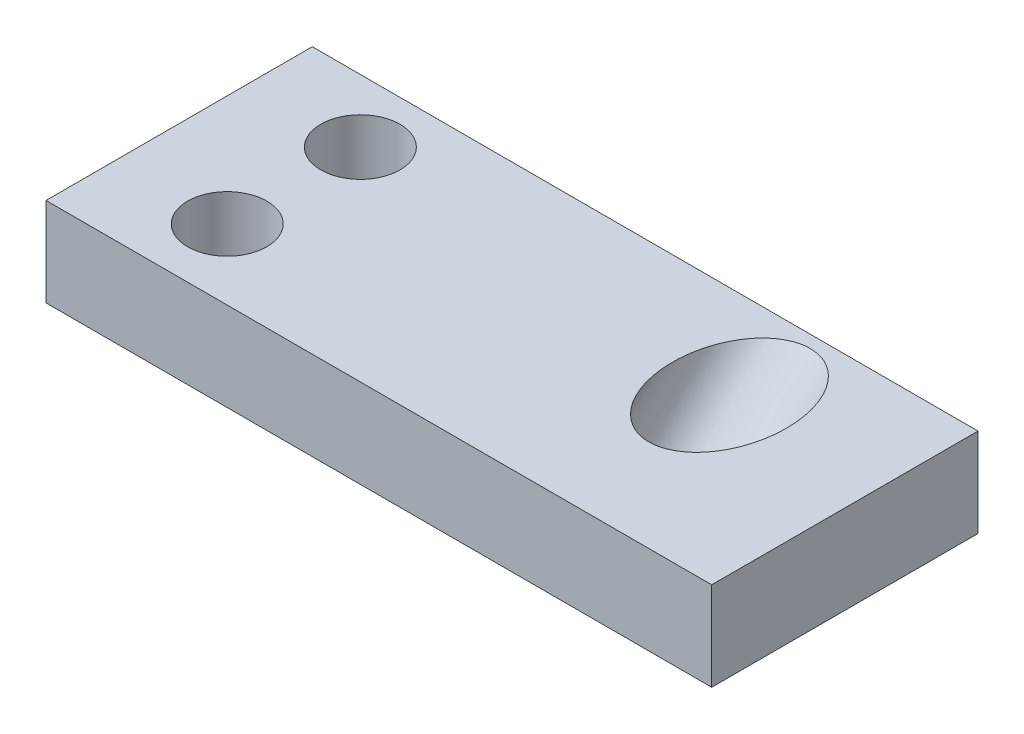
from build123d import *

# Parameters (mm, degrees)
SCHIZZO1_W                   = 30
SCHIZZO1_H                   = 12
SCHIZZO1_R                   = 1.785023435
ESTRUSIONE_ESTRUSIONE1_DEPTH = 4
SCHIZZO3_R                   = 2.575
TAGLIO_ESTRUSIONE2_DEPTH     = 25


with BuildPart() as part:
    # Schizzo1 → Estrusione-Estrusione1 (new body)
    with BuildSketch(Plane(origin=(0, 0, 0), x_dir=(1, 0, 0), z_dir=(0, 1, 0))):
        Rectangle(SCHIZZO1_W, SCHIZZO1_H)
        with Locations(Location((-10, 3.166569094, 0), (0, 0, 270))):
            Circle(SCHIZZO1_R, mode=Mode.SUBTRACT)
        with Locations(Location((-10, -2.833430906, 0), (0, 0, 270))):
            Circle(SCHIZZO1_R, mode=Mode.SUBTRACT)
    extrude(amount=ESTRUSIONE_ESTRUSIONE1_DEPTH)

    # Schizzo3 → Taglio-Estrusione2 (cut, symmetric)
    with BuildSketch(Plane(origin=(0, 2.9, -2.9), x_dir=(1, 0, 0), z_dir=(0, -0.7071067811865512, 0.7071067811865438))):
        with Locations(Location((8, 1.555634919, 0), (0, 0, 90))):
            Circle(SCHIZZO3_R)
    extrude(amount=TAGLIO_ESTRUSIONE2_DEPTH, both=True, mode=Mode.SUBTRACT)


solid = part.part
